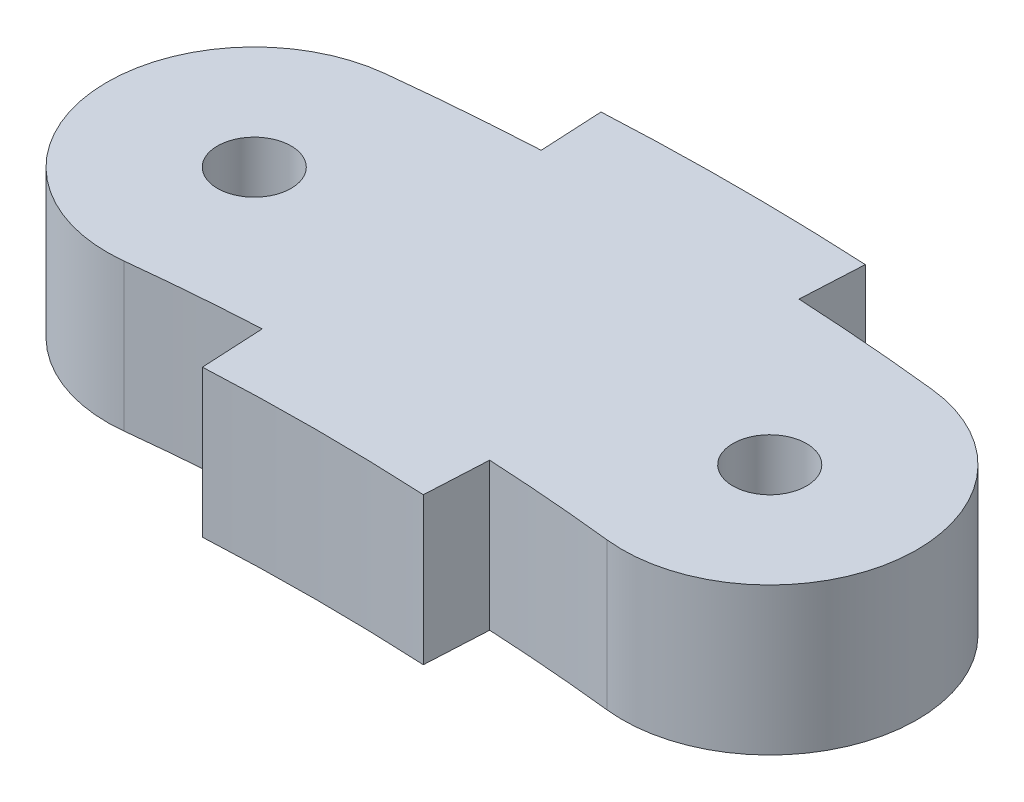
from build123d import *

# Parameters (mm, degrees)
BOSS_EXTRUDE1_DEPTH   = 5
BOSS_EXTRUDE2_DEPTH   = 10
M6X1_0_TAPPED_HOLE1_D = 5
CUT_EXTRUDE1_START    = -10
SKETCH8_R             = 2.5
CUT_EXTRUDE1_DEPTH    = 20


with BuildPart() as part:
    # Sketch1 → Boss-Extrude1 (new, symmetric)
    with BuildSketch(Plane(origin=(0, 0, 0), x_dir=(1, 0, 0), z_dir=(0, 1, 0))):
        with BuildLine():
            Line((-7.5, -0.193392624), (-8.972672616, 28.343633506))
            ThreePointArc((-8.972672616, 28.343633506), (0, 28.575), (8.972672616, 28.343633506))
            Line((8.972672616, 28.343633506), (7.5, -0.193392624))
            ThreePointArc((7.5, -0.193392624), (0, 0), (-7.5, -0.193392624))
        make_face()
    extrude(amount=BOSS_EXTRUDE1_DEPTH, both=True)

    # Sketch2 → Boss-Extrude2 (add, through all)
    with BuildSketch(Plane(origin=(0, 5, 0), x_dir=(1, 0, 0), z_dir=(0, 1, 0))):
        with BuildLine():
            ThreePointArc((-16.404975215, 3.386598502), (0, 4.2875), (16.404975215, 3.386598502))
            ThreePointArc((16.404975215, 3.386598502), (27.439865226, 12.231438943), (18.595024785, 23.266328954))
            ThreePointArc((18.595024785, 23.266328954), (0, 24.2875), (-18.595024785, 23.266328954))
            ThreePointArc((-18.595024785, 23.266328954), (-27.439865226, 12.231438943), (-16.404975215, 3.386598502))
        make_face()
    extrude(amount=-BOSS_EXTRUDE2_DEPTH)

    # M6x1.0 Tapped Hole1 (through all)
    with Locations(Plane(origin=(0, 5, 0), x_dir=(1, 0, 0), z_dir=(0, 1, 0))):
        with Locations((-17.5, 13.326463728), (17.5, 13.326463728)):
            Hole(M6X1_0_TAPPED_HOLE1_D / 2)

    # Sketch8 → Cut-Extrude1 (cut)
    with BuildSketch(Plane.XY.offset(CUT_EXTRUDE1_START)):
        Circle(SKETCH8_R)
    extrude(amount=-CUT_EXTRUDE1_DEPTH, mode=Mode.SUBTRACT)


solid = part.part
